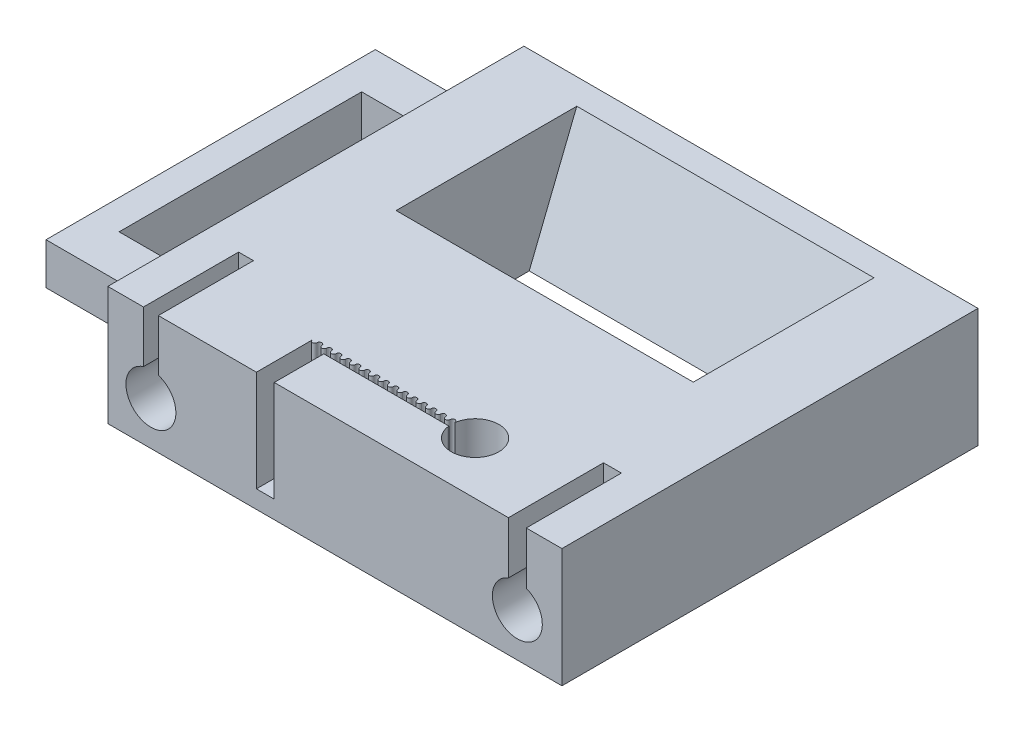
from build123d import *

# Parameters (mm, degrees)
BOSS_EXTRUDE1_DEPTH  = 20
SKETCH2_R            = 4
CUT_EXTRUDE1_DEPTH   = 17
BOSS_EXTRUDE4_DEPTH  = 17
LPATTERN14_COUNT     = 15
LPATTERN14_PITCH     = 1.6
CUT_EXTRUDE4_DEPTH   = 17
LPATTERN15_COUNT     = 15
LPATTERN15_PITCH     = 1.6
BOSS_EXTRUDE5_DEPTH  = 17
SKETCH10_W           = 2.5
SKETCH10_H           = 16
SKETCH10_W_2         = 3
CUT_EXTRUDE5_DEPTH   = 8.5
CUT_EXTRUDE7_DEPTH   = 16
SKETCH11_4_R         = 4.2
CUT_EXTRUDE8_DEPTH   = 16
CUT_EXTRUDE9_DEPTH   = 16
SKETCH12_3_R         = 4.2
CUT_EXTRUDE10_DEPTH  = 16
SKETCH19_W           = 5
SKETCH19_H           = 40.8
BOSS_EXTRUDE8_DEPTH  = 20
CUT_EXTRUDE11_DEPTH  = 6
SKETCH23_W           = 50
SKETCH23_H           = 4
SKETCH23_H_2         = 9.2
SKETCH23_H_3         = 17.2
CUT_EXTRUDE12_DEPTH  = 106.531796156
CUT_EXTRUDE15_REACH  = 126.828
SKETCH28_W           = 55.4
SKETCH28_H           = 7
BOSS_EXTRUDE10_REACH = 116.365


with BuildPart() as part:
    # Sketch1 → Boss-Extrude1 (new body)
    with BuildSketch(Plane(origin=(0, 0, 0), x_dir=(1, 0, 0), z_dir=(0, 1, 0))):
        Polygon((0, 0), (76.4, 0), (76.4, 16), (76.4, 70), (0, 70), align=None)
    extrude(amount=BOSS_EXTRUDE1_DEPTH)

    # Sketch2 → Cut-Extrude1 (cut)
    with BuildSketch(Plane(origin=(0, 20, 0), x_dir=(1, 0, 0), z_dir=(0, 1, 0))):
        with BuildLine():
            Line((25, 9.4), (25, 0))
            Line((25, 0), (28, 0))
            Line((28, 0), (28, 8.18))
            Line((28, 8.18), (49, 8.18))
            Line((49, 8.18), (49.046786118, 8.18))
            ThreePointArc((49.046786118, 8.18), (49, 8.79), (49.046786118, 9.4))
            Line((49.046786118, 9.4), (49, 9.4))
            Line((49, 9.4), (28, 9.4))
            Line((28, 9.4), (25, 9.4))
        make_face()
        with Locations((53, 8.79)):
            Circle(SKETCH2_R)
    extrude(amount=-CUT_EXTRUDE1_DEPTH, mode=Mode.SUBTRACT)

    # Sketch4 → Boss-Extrude4 (add)
    with BuildSketch(Plane(origin=(0, 20, 0), x_dir=(1, 0, 0), z_dir=(0, 1, 0))):
        with BuildLine():
            Line((25.4, 9.4), (25, 9.4))
            ThreePointArc((25, 9.4), (25.4, 9), (25.8, 9.4))
            Line((25.8, 9.4), (25.4, 9.4))
        make_face()
    boss_extrude4 = extrude(amount=-BOSS_EXTRUDE4_DEPTH)

    # LPattern14: Boss-Extrude4 ×15
    with Locations(*[(i * LPATTERN14_PITCH, 0, 0) for i in range(1, LPATTERN14_COUNT)]):
        add(boss_extrude4)

    # Sketch8 → Cut-Extrude4 (cut)
    with BuildSketch(Plane(origin=(0, 20, 0), x_dir=(1, 0, 0), z_dir=(0, 1, 0))):
        with BuildLine():
            Line((25.8, 9.4), (26.6, 9.4))
            ThreePointArc((26.6, 9.4), (26.2, 9.8), (25.8, 9.4))
        make_face()
    cut_extrude4 = extrude(amount=-CUT_EXTRUDE4_DEPTH, mode=Mode.SUBTRACT)

    # LPattern15: Cut-Extrude4 ×15
    with Locations(*[(i * LPATTERN15_PITCH, 0, 0) for i in range(1, LPATTERN15_COUNT)]):
        add(cut_extrude4, mode=Mode.SUBTRACT)

    # Sketch9 → Boss-Extrude5 (add)
    with BuildSketch(Plane(origin=(0, 20, 0), x_dir=(1, 0, 0), z_dir=(0, 1, 0))):
        Polygon((28, 8.18), (28, 8.34), (48.939227735, 8.34), (49.046786118, 8.34), (49.046786118, 8.18), align=None)
    extrude(amount=-BOSS_EXTRUDE5_DEPTH)

    # Sketch10 → Cut-Extrude5 (cut)
    with BuildSketch(Plane(origin=(0, 20, 0), x_dir=(1, 0, 0), z_dir=(0, 1, 0))):
        with Locations((7.25, 8)):
            Rectangle(SKETCH10_W, SKETCH10_H)
        with Locations((68.9, 8)):
            Rectangle(SKETCH10_W_2, SKETCH10_H)
    extrude(amount=-CUT_EXTRUDE5_DEPTH, mode=Mode.SUBTRACT)

    # Sketch11 → Cut-Extrude7 (cut)
    with BuildSketch(Plane.XY):
        with BuildLine():
            Line((7.25, 11.5), (6, 11.5))
            Line((6, 11.5), (6, 11.309675797))
            ThreePointArc((6, 11.309675797), (6.617796848, 11.452146333), (7.25, 11.5))
        make_face()
        with BuildLine():
            Line((8.5, 11.5), (7.25, 11.5))
            ThreePointArc((7.25, 11.5), (7.882203152, 11.452146333), (8.5, 11.309675797))
            Line((8.5, 11.309675797), (8.5, 11.5))
        make_face()
    extrude(amount=-CUT_EXTRUDE7_DEPTH, mode=Mode.SUBTRACT)

    # Sketch11<4> → Cut-Extrude8 (cut)
    with BuildSketch(Plane.XY):
        with Locations((7.25, 7.3)):
            Circle(SKETCH11_4_R)
    extrude(amount=-CUT_EXTRUDE8_DEPTH, mode=Mode.SUBTRACT)

    # Sketch12 → Cut-Extrude9 (cut)
    with BuildSketch(Plane.XY):
        with BuildLine():
            Line((68.9, 11.5), (67.4, 11.5))
            Line((67.4, 11.5), (67.4, 11.223009049))
            ThreePointArc((67.4, 11.223009049), (68.13731986, 11.430171789), (68.9, 11.5))
        make_face()
        with BuildLine():
            Line((70.4, 11.5), (68.9, 11.5))
            ThreePointArc((68.9, 11.5), (69.66268014, 11.430171789), (70.4, 11.223009049))
            Line((70.4, 11.223009049), (70.4, 11.5))
        make_face()
    extrude(amount=-CUT_EXTRUDE9_DEPTH, mode=Mode.SUBTRACT)

    # Sketch12<3> → Cut-Extrude10 (cut)
    with BuildSketch(Plane.XY):
        with Locations((68.9, 7.3)):
            Circle(SKETCH12_3_R)
    extrude(amount=-CUT_EXTRUDE10_DEPTH, mode=Mode.SUBTRACT)

    # Sketch19 → Boss-Extrude8 (add)
    with BuildSketch(Plane(origin=(0, 20, 0), x_dir=(1, 0, 0), z_dir=(0, 1, 0))):
        Polygon((0, 62.7), (0, 70), (-25, 70), (-25, 62.7), (-20, 62.7), align=None)
        with Locations((-22.5, 42.3)):
            Rectangle(SKETCH19_W, SKETCH19_H)
        Polygon((0, 14.6), (0, 21.9), (-20, 21.9), (-25, 21.9), (-25, 14.6), align=None)
    extrude(amount=-BOSS_EXTRUDE8_DEPTH)

    # Sketch22 → Cut-Extrude11 (cut)
    with BuildSketch(Plane(origin=(0, 20, 0), x_dir=(1, 0, 0), z_dir=(0, 1, 0))):
        Polygon((-25, 14.6), (0, 14.6), (0, 21.9), (-20, 21.9), (-20, 62.7), (0, 62.7), (0, 70), (-25, 70), align=None)
    extrude(amount=-CUT_EXTRUDE11_DEPTH, mode=Mode.SUBTRACT)

    # Sketch23 → Cut-Extrude12 (cut, through all)
    with BuildSketch(Plane(origin=(0, 20, 0), x_dir=(1, 0, 0), z_dir=(0, 1, 0))):
        with Locations((38.2, 63.7)):
            Rectangle(SKETCH23_W, SKETCH23_H)
        with Locations((38.2, 57.1)):
            Rectangle(SKETCH23_W, SKETCH23_H_2)
        with Locations((38.2, 43.9)):
            Rectangle(SKETCH23_W, SKETCH23_H_3)
    extrude(amount=-CUT_EXTRUDE12_DEPTH, mode=Mode.SUBTRACT)

    # Cut-Extrude15: up to this face of the body (flat: up to its plane)
    cut_extrude15_end = Plane(part.part.faces().sort_by_distance((0, 10.512880562, -33.751990632))[0])
    # Sketch28 → Cut-Extrude15 (cut, up to the picked face)
    with BuildSketch(Plane.ZY.offset(25), mode=Mode.PRIVATE) as cut_extrude15_sk1:
        with Locations((-42.3, 10.5)):
            Rectangle(SKETCH28_W, SKETCH28_H)
    cut_extrude15_tool1 = split(extrude(cut_extrude15_sk1.sketch, amount=-CUT_EXTRUDE15_REACH, mode=Mode.PRIVATE), bisect_by=cut_extrude15_end, keep=Keep.BOTH, mode=Mode.PRIVATE)
    add(cut_extrude15_tool1.solids().sort_by(Axis((-25, 10.5, -42.3), (1, 0, 0)))[0], mode=Mode.SUBTRACT)

    # Sketch29 → Boss-Extrude10 (add, up to next)
    with BuildSketch(Plane.ZY.offset(-63.2), mode=Mode.PRIVATE) as boss_extrude10_sk1:
        Polygon((-65.7, 0), (-57.7, 0), (-65.7, 20), align=None)
    boss_extrude10_tool1 = extrude(boss_extrude10_sk1.sketch, amount=BOSS_EXTRUDE10_REACH, mode=Mode.PRIVATE) - part.part
    # Sketch29 → Boss-Extrude10 (add, up to next)
    with BuildSketch(Plane.ZY.offset(-63.2), mode=Mode.PRIVATE) as boss_extrude10_sk2:
        Polygon((-35.3, 0), (-45.3, 0), (-35.3, 20), align=None)
    boss_extrude10_tool2 = extrude(boss_extrude10_sk2.sketch, amount=BOSS_EXTRUDE10_REACH, mode=Mode.PRIVATE) - part.part
    add(boss_extrude10_tool1.solids().sort_by_distance((63.2, 6.666667, -63.033333))[0])
    add(boss_extrude10_tool2.solids().sort_by_distance((63.2, 6.666667, -38.633333))[0])


solid = part.part
